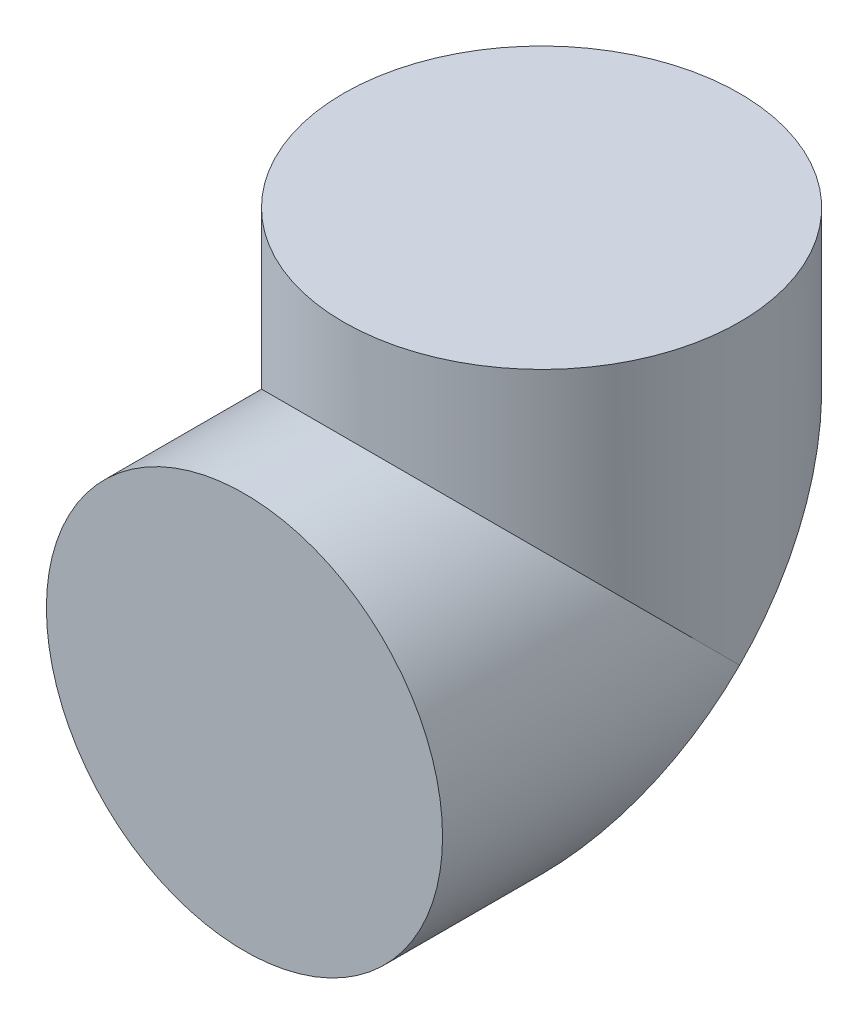
from build123d import *

# Parameters (mm, degrees)
SKETCH_3_R          = 20
EXTRUDE_2_DEPTH     = 50
SKETCH_4_R          = 20
EXTRUDE_3_DEPTH     = 50
CUT_EXTRUDE_1_DEPTH = 40
CUT_EXTRUDE_2_DEPTH = 40


with BuildPart() as part:
    # 草图3 → 凸台-拉伸2 (new body)
    with BuildSketch(Plane(origin=(0, 0, 0), x_dir=(1, 0, 0), z_dir=(0, 1, 0))):
        with Locations((0, -20)):
            Circle(SKETCH_3_R)
    extrude(amount=EXTRUDE_2_DEPTH)

    # 草图4 → 凸台-拉伸3 (add)
    with BuildSketch(Plane.XY):
        with Locations((0, 20)):
            Circle(SKETCH_4_R)
    extrude(amount=EXTRUDE_3_DEPTH)

    # 草图5 → 切除-拉伸1 (cut)
    with BuildSketch(Plane(origin=(0, 0, 0), x_dir=(0, 0, -1), z_dir=(1, 0, 0))):
        Polygon((0, 40), (-40, 0), (-40, -16.797302677), (11.409985675, -16.797302677), align=None)
    extrude(amount=-CUT_EXTRUDE_1_DEPTH, mode=Mode.SUBTRACT)

    # 草图6 → 切除-拉伸2 (cut)
    with BuildSketch(Plane.ZY):
        Polygon((0, 40), (40, 0), (42.840082068, -18.175854473), (-20.897665684, -9.087927237), align=None)
    extrude(amount=-CUT_EXTRUDE_2_DEPTH, mode=Mode.SUBTRACT)


solid = part.part
